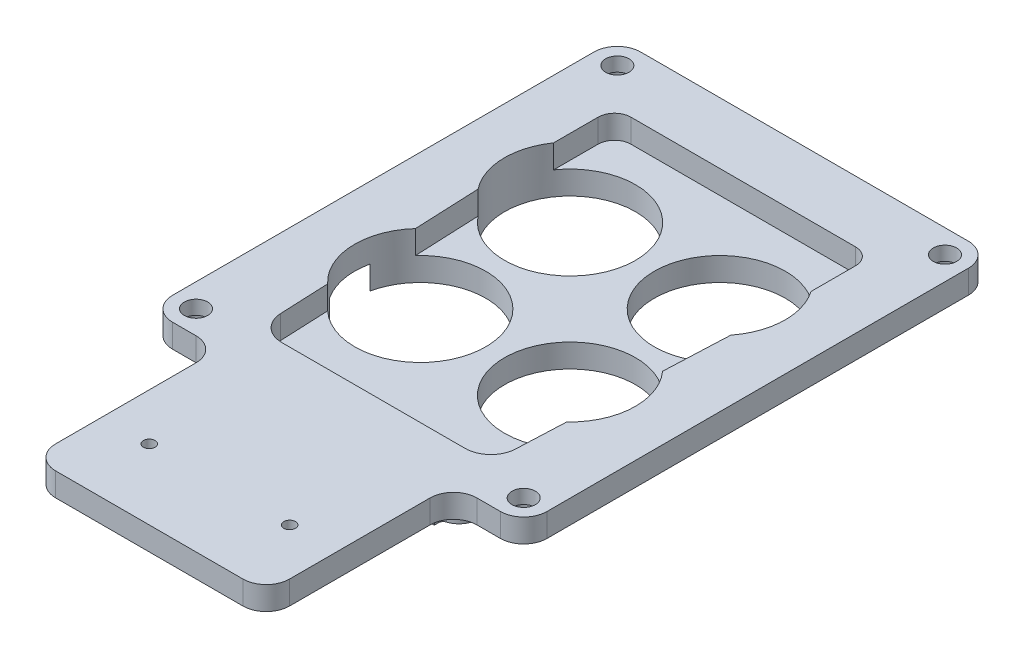
from build123d import *

# Parameters (mm, degrees)
SKETCH8_R                        = 12.5
BOSS_EXTRUDE6_DEPTH              = 5
BOSS_EXTRUDE7_DEPTH              = 5
EXTRUDE_THIN4_DEPTH              = 8
EXTRUDE_THIN4_DEPTH_BACK         = 20
SKETCH2_W                        = 70
SKETCH2_H                        = 90
BOSS_EXTRUDE8_DEPTH              = 5
BOSS_EXTRUDE9_DEPTH              = 5
BOSS_EXTRUDE10_REACH             = 81.849
SKETCH13_W                       = 6.5
SKETCH13_H                       = 17.8
BOSS_EXTRUDE10_DIRECTION_2_REACH = 81.849
SKETCH15_R                       = 2.25
CUT_EXTRUDE1_DEPTH               = 17.8
SKETCH17_W                       = 36
SKETCH17_H                       = 3
BOSS_EXTRUDE11_DEPTH             = 2
SKETCH18_W                       = 36
SKETCH18_H                       = 3
SKETCH18_W_2                     = 26
BOSS_EXTRUDE12_DEPTH             = 2
SKETCH19_W                       = 150
SKETCH19_H                       = 150
CUT_EXTRUDE2_DEPTH               = 78.271016559
SKETCH20_R                       = 2.5
CUT_EXTRUDE3_DEPTH               = 67.833823772
SKETCH21_W                       = 4.9
SKETCH21_H                       = 6.6
BOSS_EXTRUDE13_DEPTH             = 5
SKETCH22_W                       = 50
SKETCH22_H                       = 40
SKETCH22_R                       = 1.25
BOSS_EXTRUDE14_DEPTH             = 5
FILLET1_R                        = 5
SKETCH24_R                       = 3.75
CUT_EXTRUDE4_DEPTH               = 2
FILLET3_R                        = 1
SKETCH25_W                       = 33
SKETCH25_H                       = 4
CUT_EXTRUDE5_DEPTH               = 2.5
SKETCH26_R                       = 14
CUT_EXTRUDE6_DEPTH               = 97.637259895


with BuildPart() as part:
    # Sketch8 → Boss-Extrude6 (new body)
    with BuildSketch(Plane(origin=(0, 0, 0), x_dir=(-1, 0, 0), z_dir=(0, 1, 0))):
        with BuildLine():
            Line((32.15, -40), (32.15, -19))
            Line((32.15, -19), (31.233120199, 2))
            Line((31.233120199, 2), (24, 42))
            ThreePointArc((24, 42), (23.046727386, 43.953256725), (21.212767242, 45.119674618))
            ThreePointArc((21.212767242, 45.119674618), (20.697742947, 45.48055669), (20.5, 46.077535434))
            Line((20.5, 46.077535434), (20.5, 47))
            ThreePointArc((20.5, 47), (0, 48), (-20.5, 47))
            Line((-20.5, 47), (-20.5, 46.077535434))
            ThreePointArc((-20.5, 46.077535434), (-20.697742947, 45.48055669), (-21.212767242, 45.119674618))
            ThreePointArc((-21.212767242, 45.119674618), (-23.046727386, 43.953256725), (-24, 42))
            Line((-24, 42), (-31.233120199, 2))
            Line((-31.233120199, 2), (-32.15, -19))
            Line((-32.15, -19), (-32.15, -40))
            ThreePointArc((-32.15, -40), (-30.978427125, -42.828427125), (-28.15, -44))
            Line((-28.15, -44), (28.15, -44))
            ThreePointArc((28.15, -44), (30.978427125, -42.828427125), (32.15, -40))
        make_face()
        with Locations(Location((16, 13.5, 0), (0, 0, 90))):
            Circle(SKETCH8_R, mode=Mode.SUBTRACT)
        with Locations(Location((-16, 13.5, 0), (0, 0, 90))):
            Circle(SKETCH8_R, mode=Mode.SUBTRACT)
        with Locations(Location((16, -18.5, 0), (0, 0, 90))):
            Circle(SKETCH8_R, mode=Mode.SUBTRACT)
        with Locations(Location((-16, -18.5, 0), (0, 0, 90))):
            Circle(SKETCH8_R, mode=Mode.SUBTRACT)
    extrude(amount=-BOSS_EXTRUDE6_DEPTH)

    # Sketch1 → Boss-Extrude7 (add)
    # profile 1 of 3: a face of its own
    with BuildSketch(Plane(origin=(0, 0, 0), x_dir=(1, 0, 0), z_dir=(0, 1, 0))):
        with BuildLine():
            Line((-35, 52.6), (35, 52.6))
            ThreePointArc((35, 52.6), (38.535533906, 51.135533906), (40, 47.6))
            Line((40, 47.6), (40, -42.4))
            ThreePointArc((40, -42.4), (38.535533906, -45.935533906), (35, -47.4))
            Line((35, -47.4), (-35, -47.4))
            ThreePointArc((-35, -47.4), (-38.535533906, -45.935533906), (-40, -42.4))
            Line((-40, -42.4), (-40, 47.6))
            ThreePointArc((-40, 47.6), (-38.535533906, 51.135533906), (-35, 52.6))
        make_face()
        with BuildLine():
            ThreePointArc((32, 36), (29.656854249, 41.656854249), (24, 44))
            Line((24, 44), (-24, 44))
            ThreePointArc((-24, 44), (-29.656854249, 41.656854249), (-32, 36))
            Line((-32, 36), (-32, 21))
            Line((-32, 21), (-29.579603504, -34.436193874))
            ThreePointArc((-29.579603504, -34.436193874), (-26.504251846, -41.223639621), (-19.589121288, -44))
            Line((-19.589121288, -44), (19.589121288, -44))
            ThreePointArc((19.589121288, -44), (26.504251846, -41.223639621), (29.579603504, -34.436193874))
            Line((29.579603504, -34.436193874), (32, 21))
            Line((32, 21), (32, 36))
        make_face(mode=Mode.SUBTRACT)
    # profile 2 of 3: a face of its own
    with BuildSketch(Plane(origin=(0, 0, 0), x_dir=(1, 0, 0), z_dir=(0, 1, 0))):
        with BuildLine():
            Line((32, 36), (32, 21))
            Line((32, 21), (29.579603504, -34.436193874))
            ThreePointArc((29.579603504, -34.436193874), (26.504251846, -41.223639621), (19.589121288, -44))
            Line((19.589121288, -44), (-19.589121288, -44))
            ThreePointArc((-19.589121288, -44), (-26.504251846, -41.223639621), (-29.579603504, -34.436193874))
            Line((-29.579603504, -34.436193874), (-32, 21))
            Line((-32, 21), (-32, 36))
            ThreePointArc((-32, 36), (-29.656854249, 41.656854249), (-24, 44))
            Line((-24, 44), (24, 44))
            ThreePointArc((24, 44), (29.656854249, 41.656854249), (32, 36))
        make_face()
        with BuildLine():
            ThreePointArc((-24, 41), (-27.535533906, 39.535533906), (-29, 36))
            Line((-29, 36), (-29, 21.065460233))
            Line((-29, 21.065460233), (-26.582458839, -34.305335712))
            ThreePointArc((-26.582458839, -34.305335712), (-24.429712679, -39.056547734), (-19.589121288, -41))
            Line((-19.589121288, -41), (19.589121288, -41))
            ThreePointArc((19.589121288, -41), (24.429712679, -39.056547734), (26.582458839, -34.305335712))
            Line((26.582458839, -34.305335712), (29, 21.065460233))
            Line((29, 21.065460233), (29, 36))
            ThreePointArc((29, 36), (27.535533906, 39.535533906), (24, 41))
            Line((24, 41), (-24, 41))
        make_face(mode=Mode.SUBTRACT)
    # profile 3 of 3: a face of its own
    with BuildSketch(Plane(origin=(0, 0, 0), x_dir=(1, 0, 0), z_dir=(0, 1, 0))):
        with BuildLine():
            Line((-24, 41), (24, 41))
            ThreePointArc((24, 41), (27.535533906, 39.535533906), (29, 36))
            Line((29, 36), (29, 21.065460233))
            Line((29, 21.065460233), (26.582458839, -34.305335712))
            ThreePointArc((26.582458839, -34.305335712), (24.429712679, -39.056547734), (19.589121288, -41))
            Line((19.589121288, -41), (-19.589121288, -41))
            ThreePointArc((-19.589121288, -41), (-24.429712679, -39.056547734), (-26.582458839, -34.305335712))
            Line((-26.582458839, -34.305335712), (-29, 21.065460233))
            Line((-29, 21.065460233), (-29, 36))
            ThreePointArc((-29, 36), (-27.535533906, 39.535533906), (-24, 41))
        make_face()
        with BuildLine():
            ThreePointArc((-24, 39.5), (-26.474873734, 38.474873734), (-27.5, 36))
            Line((-27.5, 36), (-27.5, 21.098190349))
            Line((-27.5, 21.098190349), (-25.083886507, -34.239906631))
            ThreePointArc((-25.083886507, -34.239906631), (-23.392443095, -37.973001791), (-19.589121288, -39.5))
            Line((-19.589121288, -39.5), (19.589121288, -39.5))
            ThreePointArc((19.589121288, -39.5), (23.392443095, -37.973001791), (25.083886507, -34.239906631))
            Line((25.083886507, -34.239906631), (27.5, 21.098190349))
            Line((27.5, 21.098190349), (27.5, 36))
            ThreePointArc((27.5, 36), (26.474873734, 38.474873734), (24, 39.5))
            Line((24, 39.5), (-24, 39.5))
        make_face(mode=Mode.SUBTRACT)
    extrude(amount=BOSS_EXTRUDE7_DEPTH)

    # Sketch17 → Boss-Extrude11 (add)
    with BuildSketch(Plane(origin=(0, -5, 0), x_dir=(1, 0, 0), z_dir=(0, 1, 0))):
        with Locations((0, 45)):
            Rectangle(SKETCH17_W, SKETCH17_H)
        with BuildLine():
            Line((-12.5, -47.127867978), (-12.5, -50.133115298))
            ThreePointArc((-12.5, -50.133115298), (0, -50.5), (12.5, -50.133115298))
            Line((12.5, -50.133115298), (12.5, -47.127867978))
            ThreePointArc((12.5, -47.127867978), (0, -47.5), (-12.5, -47.127867978))
        make_face()
        Polygon((-31.5, 21.010910039), (-30.84570919, 6.025186715), (-33.842853854, 5.894328553), (-34.5, 20.945449806), (-34.5, 31.010910039), (-31.5, 31.010910039), align=None)
        Polygon((31.5, 21.010910039), (31.5, 31.010910039), (34.5, 31.010910039), (34.5, 20.945449806), (33.842853854, 5.894328553), (30.84570919, 6.025186715), align=None)
    extrude(amount=BOSS_EXTRUDE11_DEPTH)

    # Sketch20 → Cut-Extrude3 (cut, through all)
    with BuildSketch(Plane(origin=(0, 5, 0), x_dir=(1, 0, 0), z_dir=(0, 1, 0))):
        with Locations(Location((-35, 47.6, 0), (0, 0, 270))):
            Circle(SKETCH20_R)
        with Locations(Location((35, 47.6, 0), (0, 0, 270))):
            Circle(SKETCH20_R)
        with Locations(Location((-35, -42.4, 0), (0, 0, 270))):
            Circle(SKETCH20_R)
        with Locations(Location((35, -42.4, 0), (0, 0, 270))):
            Circle(SKETCH20_R)
    extrude(amount=-CUT_EXTRUDE3_DEPTH, mode=Mode.SUBTRACT)

    # Sketch21 → Boss-Extrude13 (add)
    with BuildSketch(Plane.XZ.offset(5)):
        with Locations((-10.6, 32.2)):
            Rectangle(SKETCH21_W, SKETCH21_H)
        with Locations((10.6, 32.2)):
            Rectangle(SKETCH21_W, SKETCH21_H)
    extrude(amount=BOSS_EXTRUDE13_DEPTH)

    # Sketch22 → Boss-Extrude14 (add)
    with BuildSketch(Plane(origin=(0, 5, 0), x_dir=(1, 0, 0), z_dir=(0, 1, 0))):
        with Locations((0, -67.4)):
            Rectangle(SKETCH22_W, SKETCH22_H)
        with Locations(Location((15, -72.4, 0), (0, 0, 270))):
            Circle(SKETCH22_R, mode=Mode.SUBTRACT)
        with Locations(Location((-15, -72.4, 0), (0, 0, 270))):
            Circle(SKETCH22_R, mode=Mode.SUBTRACT)
    extrude(amount=-BOSS_EXTRUDE14_DEPTH)

    # Fillet1
    fillet1_edges = [part.edges().sort_by_distance(p)[0] for p in [
        (-25, 2.5, 87.4),
        (-25, 2.5, 47.4),
        (25, 2.5, 47.4),
        (25, 2.5, 87.4),
    ]]
    fillet(fillet1_edges, radius=FILLET1_R)

    # Sketch24 → Cut-Extrude4 (cut)
    with BuildSketch(Plane.XZ):
        with Locations(Location((35, -47.6, 0), (0, 0, 270))):
            Circle(SKETCH24_R)
        with Locations(Location((-35, -47.6, 0), (0, 0, 270))):
            Circle(SKETCH24_R)
        with Locations(Location((35, 42.4, 0), (0, 0, 270))):
            Circle(SKETCH24_R)
        with Locations(Location((-35, 42.4, 0), (0, 0, 270))):
            Circle(SKETCH24_R)
    extrude(amount=-CUT_EXTRUDE4_DEPTH, mode=Mode.SUBTRACT)

    # Fillet3
    fillet3_edges = [part.edges().sort_by_distance(p)[0] for p in [
        (-13.05, -7.5, 35.5),
        (-13.05, -7.5, 28.9),
        (-8.15, -7.5, 28.9),
        (-8.15, -7.5, 35.5),
        (-13.05, -10, 32.2),
        (-10.6, -10, 28.9),
        (-8.15, -10, 32.2),
        (-10.6, -10, 35.5),
        (13.05, -7.5, 35.5),
        (8.15, -7.5, 35.5),
        (8.15, -7.5, 28.9),
        (13.05, -7.5, 28.9),
        (10.6, -10, 35.5),
        (8.15, -10, 32.2),
        (10.6, -10, 28.9),
        (13.05, -10, 32.2),
    ]]
    fillet(fillet3_edges, radius=FILLET3_R)

    # Sketch25 → Cut-Extrude5 (cut)
    with BuildSketch(Plane.XZ.offset(5)):
        with Locations((0, -41)):
            Rectangle(SKETCH25_W, SKETCH25_H)
    extrude(amount=-CUT_EXTRUDE5_DEPTH, mode=Mode.SUBTRACT)

    # Sketch26 → Cut-Extrude6 (cut, through all)
    with BuildSketch(Plane.XZ.offset(5)):
        with Locations(Location((16, -18.5, 0), (0, 0, 270))):
            Circle(SKETCH26_R)
        with Locations(Location((16, 13.5, 0), (0, 0, 317.967290466))):
            Circle(SKETCH26_R)
        with Locations(Location((-16, 13.5, 0), (0, 0, 222.032709534))):
            Circle(SKETCH26_R)
        with Locations(Location((-16, -18.5, 0), (0, 0, 270))):
            Circle(SKETCH26_R)
    extrude(amount=-CUT_EXTRUDE6_DEPTH, mode=Mode.SUBTRACT)


with BuildPart() as body_2:
    # Sketch2 → Extrude-Thin4 (new, two sides: drawn at the far end of the back side and taken through both)
    with BuildSketch(Plane(origin=(0, 25, 0), x_dir=(1, 0, 0), z_dir=(0, 1, 0)).offset(-EXTRUDE_THIN4_DEPTH_BACK)):
        with BuildLine():
            Line((-40, 49.1), (-40, -40.9))
            ThreePointArc((-40, -40.9), (-38.535533906, -44.435533906), (-35, -45.9))
            Line((-35, -45.9), (35, -45.9))
            ThreePointArc((35, -45.9), (38.535533906, -44.435533906), (40, -40.9))
            Line((40, -40.9), (40, 49.1))
            ThreePointArc((40, 49.1), (38.535533906, 52.635533906), (35, 54.1))
            Line((35, 54.1), (-35, 54.1))
            ThreePointArc((-35, 54.1), (-38.535533906, 52.635533906), (-40, 49.1))
        make_face()
        with Locations((0, 4.1)):
            Rectangle(SKETCH2_W, SKETCH2_H, mode=Mode.SUBTRACT)
    extrude(amount=EXTRUDE_THIN4_DEPTH + EXTRUDE_THIN4_DEPTH_BACK)

    # Sketch13 → Boss-Extrude10 (add, up to next)
    with BuildSketch(Plane(origin=(0, 0, 0), x_dir=(0, 0, -1), z_dir=(1, 0, 0)), mode=Mode.PRIVATE) as boss_extrude10_sk1:
        with Locations((45.85, 20)):
            Rectangle(SKETCH13_W, SKETCH13_H)
    boss_extrude10_tool1 = extrude(boss_extrude10_sk1.sketch, amount=BOSS_EXTRUDE10_REACH, mode=Mode.PRIVATE) - body_2.part
    # Sketch13 → Boss-Extrude10 (add, up to next)
    with BuildSketch(Plane(origin=(0, 0, 0), x_dir=(0, 0, -1), z_dir=(1, 0, 0)), mode=Mode.PRIVATE) as boss_extrude10_sk2:
        with Locations((-37.65, 20)):
            Rectangle(SKETCH13_W, SKETCH13_H)
    boss_extrude10_tool2 = extrude(boss_extrude10_sk2.sketch, amount=BOSS_EXTRUDE10_REACH, mode=Mode.PRIVATE) - body_2.part
    add(boss_extrude10_tool1.solids().sort_by_distance((0, 20, -45.85))[0])
    add(boss_extrude10_tool2.solids().sort_by_distance((0, 20, 37.65))[0])

    # Sketch13 → Boss-Extrude10 direction 2 (add, up to next)
    with BuildSketch(Plane(origin=(0, 0, 0), x_dir=(0, 0, -1), z_dir=(1, 0, 0)), mode=Mode.PRIVATE) as boss_extrude10_direction_2_sk1:
        with Locations((45.85, 20)):
            Rectangle(SKETCH13_W, SKETCH13_H)
    boss_extrude10_direction_2_tool1 = extrude(boss_extrude10_direction_2_sk1.sketch, amount=-BOSS_EXTRUDE10_DIRECTION_2_REACH, mode=Mode.PRIVATE) - body_2.part
    # Sketch13 → Boss-Extrude10 direction 2 (add, up to next)
    with BuildSketch(Plane(origin=(0, 0, 0), x_dir=(0, 0, -1), z_dir=(1, 0, 0)), mode=Mode.PRIVATE) as boss_extrude10_direction_2_sk2:
        with Locations((-37.65, 20)):
            Rectangle(SKETCH13_W, SKETCH13_H)
    boss_extrude10_direction_2_tool2 = extrude(boss_extrude10_direction_2_sk2.sketch, amount=-BOSS_EXTRUDE10_DIRECTION_2_REACH, mode=Mode.PRIVATE) - body_2.part
    add(boss_extrude10_direction_2_tool1.solids().sort_by_distance((0, 20, -45.85))[0])
    add(boss_extrude10_direction_2_tool2.solids().sort_by_distance((0, 20, 37.65))[0])

    # Sketch15 → Cut-Extrude1 (cut)
    with BuildSketch(Plane.XZ.offset(-11.1)):
        with Locations((-21.9, -44)):
            Circle(SKETCH15_R)
        with Locations((-9.9, -44)):
            Circle(SKETCH15_R)
        with Locations((-21.9, 35.8)):
            Circle(SKETCH15_R)
        with Locations((-9.9, 35.8)):
            Circle(SKETCH15_R)
        with Locations((9.9, 35.8)):
            Circle(SKETCH15_R)
        with Locations((21.9, 35.8)):
            Circle(SKETCH15_R)
        with Locations((9.9, -44)):
            Circle(SKETCH15_R)
        with Locations((21.9, -44)):
            Circle(SKETCH15_R)
    extrude(amount=-CUT_EXTRUDE1_DEPTH, mode=Mode.SUBTRACT)


with BuildPart() as body_3:
    # Sketch10 → Boss-Extrude8 (new body)
    with BuildSketch(Plane(origin=(0, 38, 0), x_dir=(1, 0, 0), z_dir=(0, 1, 0))):
        with BuildLine():
            Line((-32, 36), (-32, 21))
            Line((-32, 21), (-29.579603504, -34.436193874))
            ThreePointArc((-29.579603504, -34.436193874), (-26.504251846, -41.223639621), (-19.589121288, -44))
            Line((-19.589121288, -44), (19.589121288, -44))
            ThreePointArc((19.589121288, -44), (26.504251846, -41.223639621), (29.579603504, -34.436193874))
            Line((29.579603504, -34.436193874), (32, 21))
            Line((32, 21), (32, 36))
            ThreePointArc((32, 36), (29.656854249, 41.656854249), (24, 44))
            Line((24, 44), (-24, 44))
            ThreePointArc((-24, 44), (-29.656854249, 41.656854249), (-32, 36))
        make_face()
    extrude(amount=BOSS_EXTRUDE8_DEPTH)

    # Sketch11 → Boss-Extrude9 (add)
    with BuildSketch(Plane(origin=(0, 38, 0), x_dir=(1, 0, 0), z_dir=(0, 1, 0))):
        with BuildLine():
            Line((-35, -45.9), (35, -45.9))
            ThreePointArc((35, -45.9), (38.535533906, -44.435533906), (40, -40.9))
            Line((40, -40.9), (40, 49.1))
            ThreePointArc((40, 49.1), (38.535533906, 52.635533906), (35, 54.1))
            Line((35, 54.1), (-35, 54.1))
            ThreePointArc((-35, 54.1), (-38.535533906, 52.635533906), (-40, 49.1))
            Line((-40, 49.1), (-40, -40.9))
            ThreePointArc((-40, -40.9), (-38.535533906, -44.435533906), (-35, -45.9))
        make_face()
    extrude(amount=-BOSS_EXTRUDE9_DEPTH)

    # Sketch18 → Boss-Extrude12 (add)
    with BuildSketch(Plane(origin=(0, 43, 0), x_dir=(1, 0, 0), z_dir=(0, 1, 0))):
        with Locations((0, 45)):
            Rectangle(SKETCH18_W, SKETCH18_H)
        with Locations((0, -45)):
            Rectangle(SKETCH18_W_2, SKETCH18_H)
        Polygon((-31.5, 21.010910039), (-30.84570919, 6.025186715), (-33.842853854, 5.894328553), (-34.5, 20.945449806), (-34.5, 31.010910039), (-31.5, 31.010910039), align=None)
        Polygon((31.5, 21.010910039), (31.5, 31.010910039), (34.5, 31.010910039), (34.5, 20.945449806), (33.842853854, 5.894328553), (30.84570919, 6.025186715), align=None)
    extrude(amount=-BOSS_EXTRUDE12_DEPTH)


with BuildPart() as cut_extrude2_tool:
    # Sketch19 → Cut-Extrude2 (new, through all)
    with BuildSketch(Plane(origin=(0, 5, 0), x_dir=(1, 0, 0), z_dir=(0, 1, 0))):
        Rectangle(SKETCH19_W, SKETCH19_H)
    extrude(amount=CUT_EXTRUDE2_DEPTH)


with BuildPart() as body_2_1:
    add(body_2.part)

    # Cut-Extrude2: cut by cut_extrude2_tool
    add(cut_extrude2_tool.part, mode=Mode.SUBTRACT)


with BuildPart() as body_3_1:
    add(body_3.part)

    # Cut-Extrude2: cut by cut_extrude2_tool
    add(cut_extrude2_tool.part, mode=Mode.SUBTRACT)


solid = part.part
